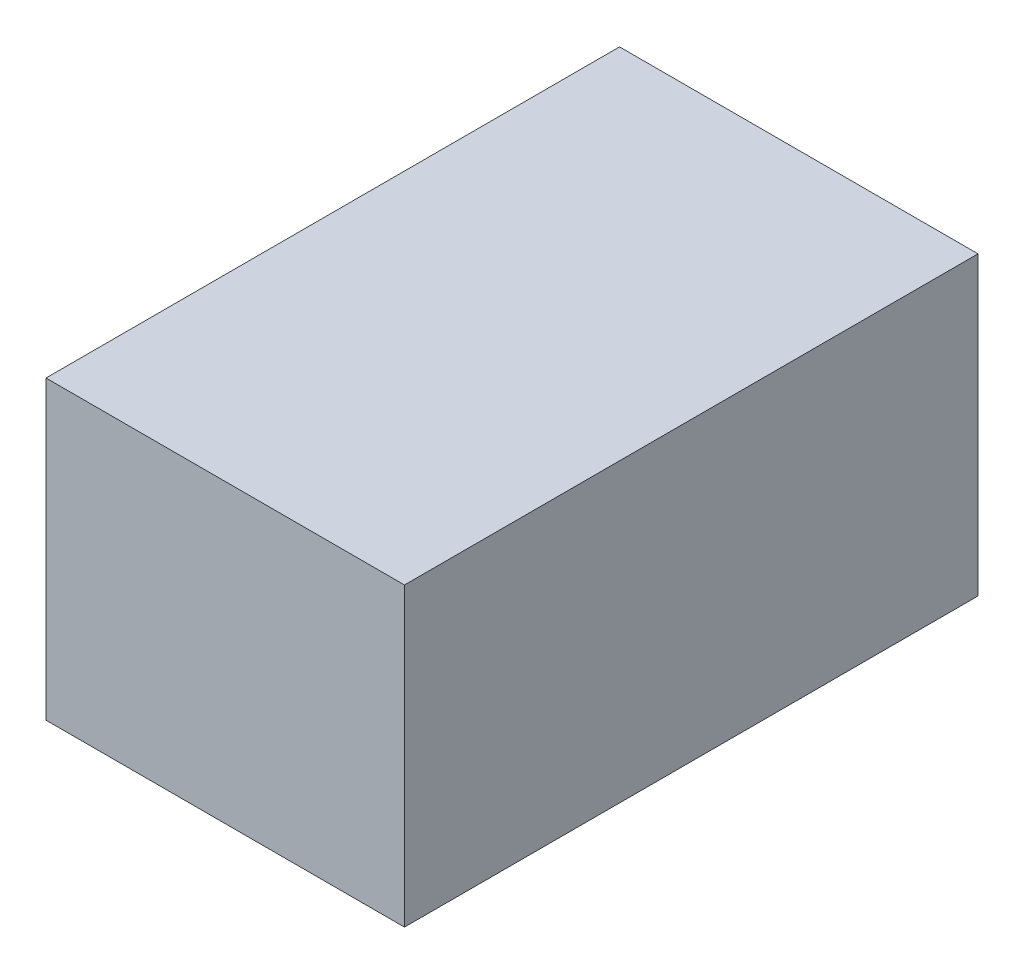
from build123d import *

# Parameters (mm, degrees)
SKETCH_2_W      = 75
SKETCH_2_H      = 120
EXTRUDE_1_DEPTH = 62


with BuildPart() as part:
    # 草图2 → 凸台-拉伸1 (new body)
    with BuildSketch(Plane(origin=(0, 0, 0), x_dir=(1, 0, 0), z_dir=(0, 1, 0))):
        Rectangle(SKETCH_2_W, SKETCH_2_H)
    extrude(amount=EXTRUDE_1_DEPTH)


solid = part.part
